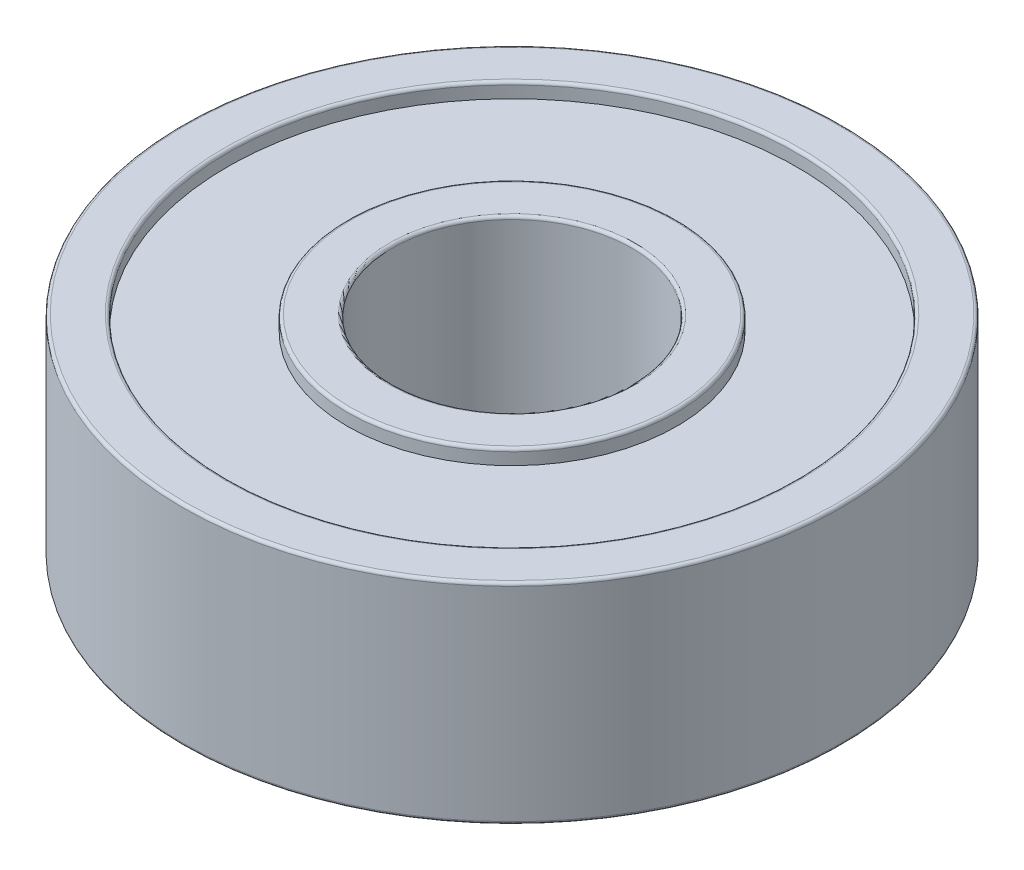
from build123d import *

# Parameters (mm, degrees)
BOSS_EXTRUDE1_DEPTH      = 3.5
BOSS_EXTRUDE1_DEPTH_BACK = 3.5
SKETCH1_R                = 11
SKETCH1_R_2              = 4
SKETCH2_R                = 9.5
SKETCH2_R_2              = 5.5
CUT_EXTRUDE1_DEPTH       = 0.5
FILLET2_R                = 0.1
FILLET3_R                = 0.1


with BuildPart() as part:
    # Sketch1 → Boss-Extrude1 (new, two sides: drawn at the far end of the back side and taken through both)
    with BuildSketch(Plane(origin=(0, 0, 0), x_dir=(1, 0, 0), z_dir=(0, 1, 0)).offset(-BOSS_EXTRUDE1_DEPTH_BACK)):
        with Locations(Location((0, 0, 0), (0, 0, 270))):
            Circle(SKETCH1_R)
        with Locations(Location((0, 0, 0), (0, 0, 270))):
            Circle(SKETCH1_R_2, mode=Mode.SUBTRACT)
    extrude(amount=BOSS_EXTRUDE1_DEPTH + BOSS_EXTRUDE1_DEPTH_BACK)

    # Sketch2 → Cut-Extrude1 (cut)
    with BuildSketch(Plane(origin=(0, 3.5, 0), x_dir=(1, 0, 0), z_dir=(0, 1, 0))):
        with Locations(Location((0, 0, 0), (0, 0, 270))):
            Circle(SKETCH2_R)
        with Locations(Location((0, 0, 0), (0, 0, 270))):
            Circle(SKETCH2_R_2, mode=Mode.SUBTRACT)
    cut_extrude1 = extrude(amount=-CUT_EXTRUDE1_DEPTH, mode=Mode.SUBTRACT)

    # Fillet2
    fillet2_edges = [part.edges().sort_by_distance(p)[0] for p in [
        (0, 3.5, -9.5),
        (0, 3.5, -5.5),
        (0, 3.5, -11),
        (0, 3.5, -4),
    ]]
    fillet(fillet2_edges, radius=FILLET2_R)

    # Mirror4: Cut-Extrude1 across plane
    add(cut_extrude1.mirror(Plane.ZX), mode=Mode.SUBTRACT)

    # Fillet3
    fillet3_edges = [part.edges().sort_by_distance(p)[0] for p in [
        (0, -3.5, -5.5),
        (0, -3.5, -9.5),
        (0, -3.5, -11),
        (0, -3.5, -4),
    ]]
    fillet(fillet3_edges, radius=FILLET3_R)


solid = part.part
